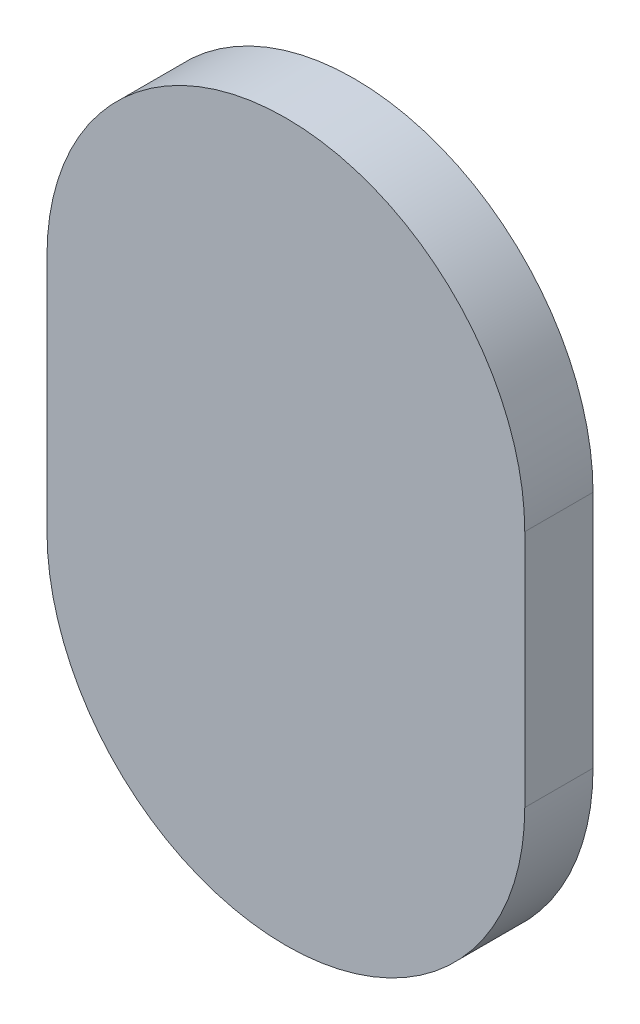
from build123d import *

# Parameters (mm, degrees)
SKETCH_1_R      = 35
EXTRUDE_1_DEPTH = 10


with BuildPart() as part:
    # Эскиз1 → Бобышка-Вытянуть1 (new body)
    with BuildSketch(Plane.XY):
        with BuildLine():
            ThreePointArc((-30.310889132, 17.5), (-33.80740392, 25.941333421), (-35, 35))
            Line((-35, 35), (-35, 0))
            ThreePointArc((-35, 0), (-33.80740392, 9.058666579), (-30.310889132, 17.5))
        make_face()
        with Locations((0, 35)):
            Circle(SKETCH_1_R)
        Circle(SKETCH_1_R)
        with BuildLine():
            Line((35, 0), (35, 35))
            ThreePointArc((35, 35), (33.80740392, 25.941333421), (30.310889132, 17.5))
            ThreePointArc((30.310889132, 17.5), (33.80740392, 9.058666579), (35, 0))
        make_face()
    extrude(amount=EXTRUDE_1_DEPTH)


solid = part.part
